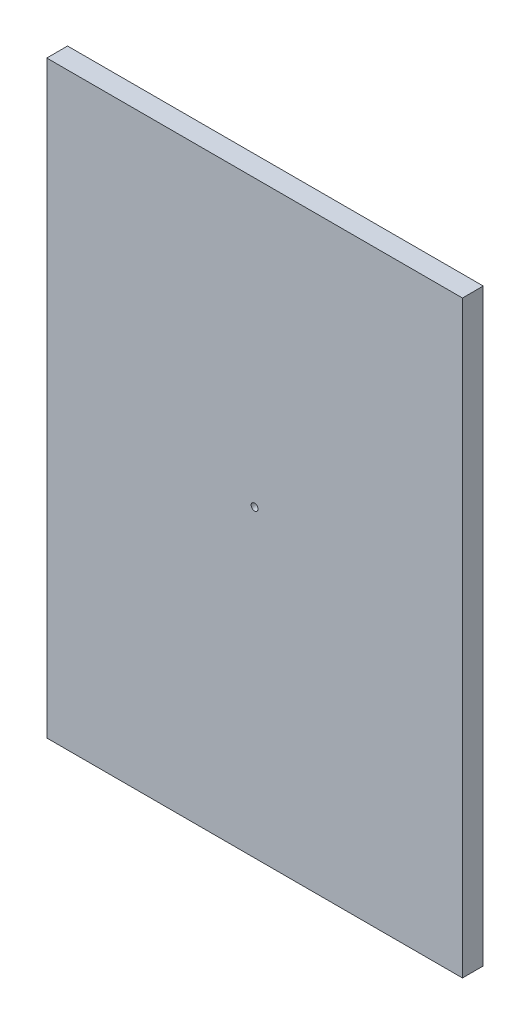
from build123d import *

# Parameters (mm, degrees)
SKETCH1_W           = 60
SKETCH1_H           = 85
SKETCH1_R           = 0.5
BOSS_EXTRUDE1_DEPTH = 3


with BuildPart() as part:
    # Sketch1 → Boss-Extrude1 (new body)
    with BuildSketch(Plane.XY):
        with Locations((30, -42.5)):
            Rectangle(SKETCH1_W, SKETCH1_H)
        with Locations((30, -41.14)):
            Circle(SKETCH1_R, mode=Mode.SUBTRACT)
    extrude(amount=BOSS_EXTRUDE1_DEPTH)


solid = part.part
